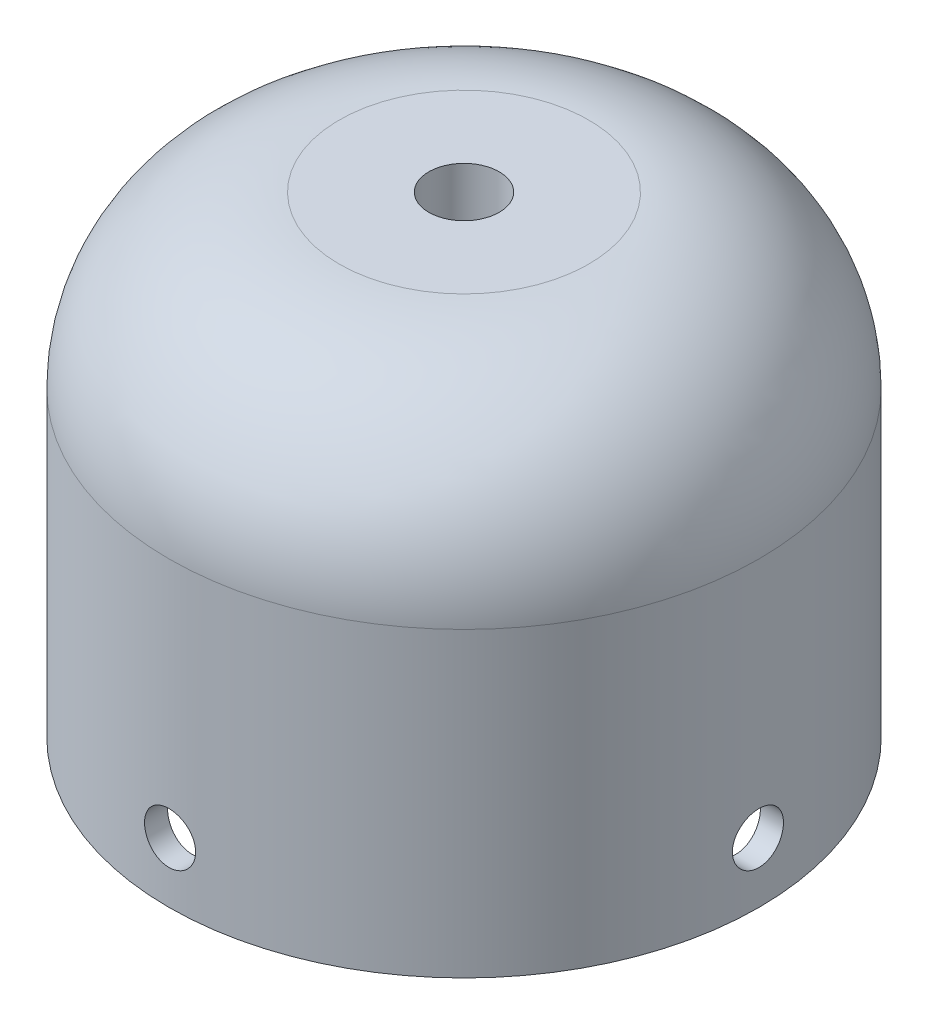
from build123d import *

# Parameters (mm, degrees)
SKETCH6_R          = 2.25
CUT_EXTRUDE1_DEPTH = 10
CIRPATTERN1_COUNT  = 4
SKETCH7_R          = 26
CUT_EXTRUDE2_DEPTH = 0.2
SKETCH8_R          = 11.55
SKETCH8_R_2        = 8.95
CUT_EXTRUDE3_DEPTH = 1.3
FILLET1_R          = 0.3


with BuildPart() as part:
    # Sketch1 → Revolve2 (revolve)
    with BuildSketch(Plane(origin=(0, 0, 0), x_dir=(0, 0, -1), z_dir=(1, 0, 0))):
        Polygon((-26, -26.8), (-23.975, -26.8), (-23.975, -16.467157288), (-23.225, -15.717157288), (-23.225, -0.917157288), (-22.107842712, 0.2), (-8.475, 0.2), (-3.1, 0.2), (-3.1, 15), (-26, 15), align=None)
    revolve(axis=Axis((0, 42.157107232, 0), (0, -1, 0)))

    # Sketch5 → Cut-Revolve1 (revolve, cut)
    with BuildSketch(Plane.XY, mode=Mode.PRIVATE) as cut_revolve1_sk:
        with BuildLine():
            Line((-26, 15), (-11, 15))
            ThreePointArc((-11, 15), (-21.606601718, 10.606601718), (-26, 0))
            Line((-26, 0), (-26, 15))
        make_face()
    revolve(cut_revolve1_sk.sketch.rotate(Axis((0, 20, 0), (0, -1, 0)), 270), axis=Axis((0, 20, 0), (0, -1, 0)), mode=Mode.SUBTRACT)

    # Sketch6 → Cut-Extrude1 (cut)
    with BuildSketch(Plane.ZY.offset(26)):
        with Locations((0, -21.3)):
            Circle(SKETCH6_R)
    cut_extrude1 = extrude(amount=-CUT_EXTRUDE1_DEPTH, mode=Mode.SUBTRACT)

    # CirPattern1: Cut-Extrude1 ×4 about axis
    cirpattern1_axis = Axis((0, -26.8, 0), (0, 1, 0))
    for i in range(1, CIRPATTERN1_COUNT):
        add(cut_extrude1.rotate(cirpattern1_axis, i * 360 / CIRPATTERN1_COUNT), mode=Mode.SUBTRACT)

    # Sketch7 → Cut-Extrude2 (cut)
    with BuildSketch(Plane.XZ.offset(26.8)):
        with Locations(Location((0, 0, 0), (0, 0, 90))):
            Circle(SKETCH7_R)
    extrude(amount=-CUT_EXTRUDE2_DEPTH, mode=Mode.SUBTRACT)

    # Sketch8 → Cut-Extrude3 (cut)
    with BuildSketch(Plane.XZ.offset(-0.2)):
        with Locations(Location((0, 0, 0), (0, 0, 270))):
            Circle(SKETCH8_R)
        with Locations(Location((0, 0, 0), (0, 0, 270))):
            Circle(SKETCH8_R_2, mode=Mode.SUBTRACT)
    extrude(amount=-CUT_EXTRUDE3_DEPTH, mode=Mode.SUBTRACT)

    # Fillet1
    fillet1_edges = [part.edges().sort_by_distance(p)[0] for p in [
        (0, 1.5, 11.55),
        (0, 1.5, 8.95),
    ]]
    fillet(fillet1_edges, radius=FILLET1_R)


solid = part.part
